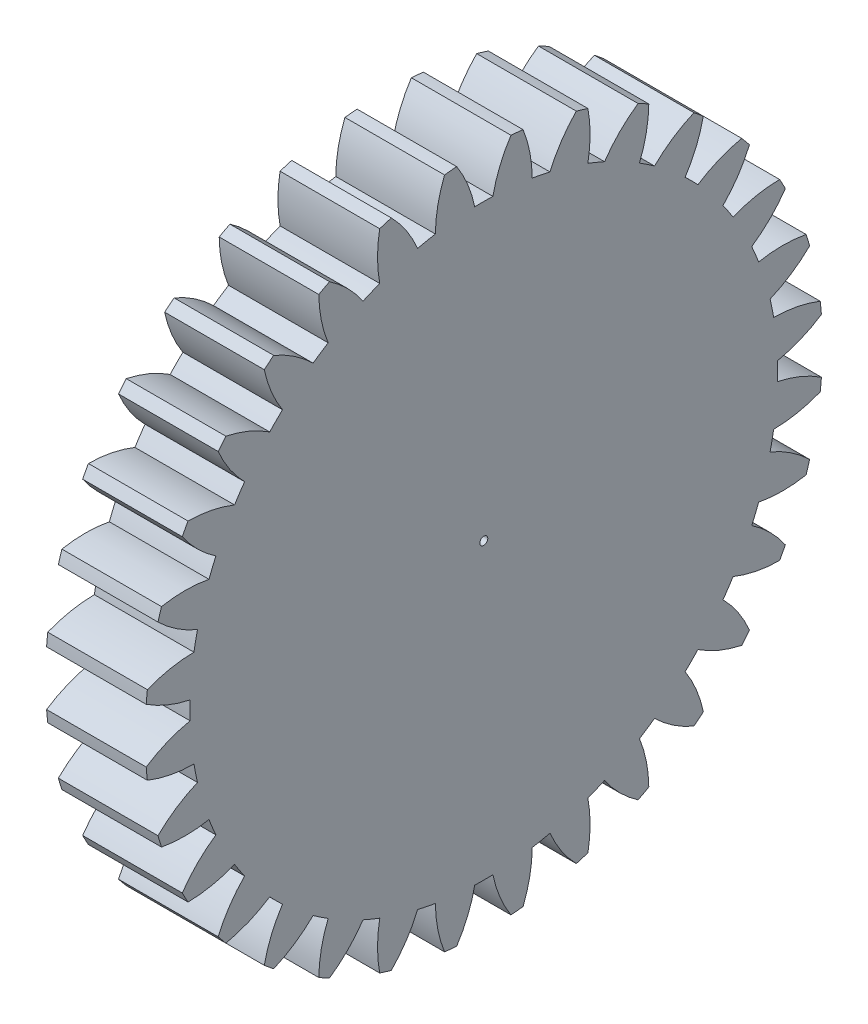
from build123d import *

# Parameters (mm, degrees)
BASPROSKE_W     = 10
BASPROSKE_H     = 34
TOOTHCUT_DEPTH  = 50.112116631
TEETHCUTS_COUNT = 32
TEETHCUTS_ANGLE = 348.75
BORSKE_R        = 0.4
BORE_DEPTH      = 50.0000508


with BuildPart() as part:
    # BasProSke → Base-Revolve (revolve)
    with BuildSketch(Plane(origin=(0, 0, 0), x_dir=(1, 0, 0), z_dir=(0, 1, 0)), mode=Mode.PRIVATE) as base_revolve_sk:
        with Locations((5, 17)):
            Rectangle(BASPROSKE_W, BASPROSKE_H)
    revolve(base_revolve_sk.sketch.rotate(Axis((-10, 0, 0), (1, 0, 0)), 180), axis=Axis((-10, 0, 0), (1, 0, 0)))

    # TooCutSke → ToothCut (cut, through all)
    with BuildSketch(Plane(origin=(0, 0, 0), x_dir=(0, 0, -1), z_dir=(1, 0, 0))):
        with BuildLine():
            ThreePointArc((0.90975268, 29.484968222), (0, 29.499), (-0.90975268, 29.484968222))
            ThreePointArc((-0.90975268, 29.484968222), (-1.616072745, 31.786377155), (-2.740819811, 33.914830855))
            ThreePointArc((-2.740819811, 33.914830855), (0, 34.0254), (2.740819811, 33.914830855))
            ThreePointArc((2.740819811, 33.914830855), (1.616072745, 31.786377155), (0.90975268, 29.484968222))
        make_face()
    toothcut = extrude(amount=TOOTHCUT_DEPTH, mode=Mode.SUBTRACT)

    # TeethCuts: ToothCut ×32 about axis
    teethcuts_axis = Axis((-10, 0, 0), (1, 0, 0))
    for i in range(1, TEETHCUTS_COUNT):
        add(toothcut.rotate(teethcuts_axis, i * TEETHCUTS_ANGLE / (TEETHCUTS_COUNT - 1)), mode=Mode.SUBTRACT)

    # BorSke → Bore (cut, symmetric)
    with BuildSketch(Plane(origin=(0, 0, 0), x_dir=(0, 0, -1), z_dir=(1, 0, 0))):
        with Locations(Location((0, 0, 0), (0, 0, 180))):
            Circle(BORSKE_R)
    extrude(amount=BORE_DEPTH, both=True, mode=Mode.SUBTRACT)


solid = part.part
